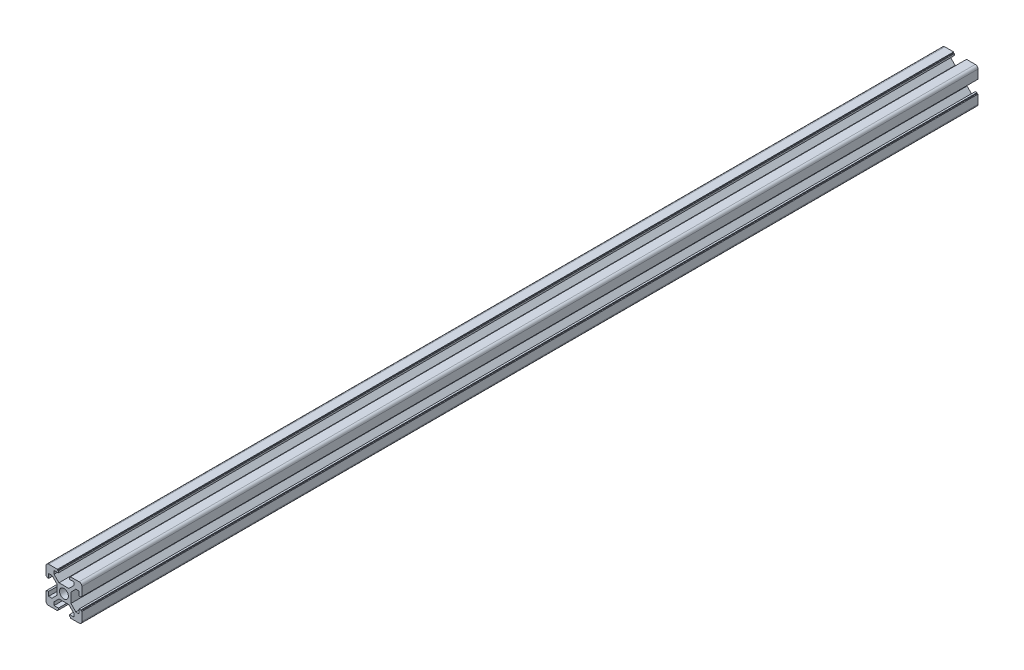
from build123d import *
from build123d.topology import SkipClean

# Parameters (mm, degrees)
EXTRUDE_1_DEPTH     = 500
SKETCH_2_R          = 2.05
CUT_EXTRUDE_1_DEPTH = 501.293124078
SKETCH_3_R          = 2.05
CUT_EXTRUDE_2_DEPTH = 27


with BuildPart() as part:
    # 草图1 → 凸台-拉伸1 (new body)
    with BuildSketch(Plane.XY):
        with BuildLine():
            Line((8.5, 10), (3.6, 10))
            Line((3.6, 10), (3.6, 9.5))
            Line((3.6, 9.5), (3.1, 9.5))
            Line((3.1, 9.5), (3.1, 8.5))
            Line((3.1, 8.5), (5.5, 8.5))
            Line((5.5, 8.5), (5.5, 6.65))
            Line((5.5, 6.65), (2.75, 3.9))
            Line((2.75, 3.9), (-2.75, 3.9))
            Line((-2.75, 3.9), (-5.5, 6.65))
            Line((-5.5, 6.65), (-5.5, 8.5))
            Line((-5.5, 8.5), (-3.1, 8.5))
            Line((-3.1, 8.5), (-3.1, 9.5))
            Line((-3.1, 9.5), (-3.6, 9.5))
            Line((-3.6, 9.5), (-3.6, 10))
            Line((-3.6, 10), (-8.5, 10))
            ThreePointArc((-8.5, 10), (-9.560660172, 9.560660172), (-10, 8.5))
            Line((-10, 8.5), (-10, 3.6))
            Line((-10, 3.6), (-9.5, 3.6))
            Line((-9.5, 3.6), (-9.5, 3.1))
            Line((-9.5, 3.1), (-8.5, 3.1))
            Line((-8.5, 3.1), (-8.5, 5.5))
            Line((-8.5, 5.5), (-6.65, 5.5))
            Line((-6.65, 5.5), (-3.9, 2.75))
            Line((-3.9, 2.75), (-3.9, -2.75))
            Line((-3.9, -2.75), (-6.65, -5.5))
            Line((-6.65, -5.5), (-8.5, -5.5))
            Line((-8.5, -5.5), (-8.5, -3.1))
            Line((-8.5, -3.1), (-9.5, -3.1))
            Line((-9.5, -3.1), (-9.5, -3.6))
            Line((-9.5, -3.6), (-10, -3.6))
            Line((-10, -3.6), (-10, -8.5))
            ThreePointArc((-10, -8.5), (-9.560660172, -9.560660172), (-8.5, -10))
            Line((-8.5, -10), (-3.6, -10))
            Line((-3.6, -10), (-3.6, -9.5))
            Line((-3.6, -9.5), (-3.1, -9.5))
            Line((-3.1, -9.5), (-3.1, -8.5))
            Line((-3.1, -8.5), (-5.5, -8.5))
            Line((-5.5, -8.5), (-5.5, -6.65))
            Line((-5.5, -6.65), (-2.75, -3.9))
            Line((-2.75, -3.9), (2.75, -3.9))
            Line((2.75, -3.9), (5.5, -6.65))
            Line((5.5, -6.65), (5.5, -8.5))
            Line((5.5, -8.5), (3.1, -8.5))
            Line((3.1, -8.5), (3.1, -9.5))
            Line((3.1, -9.5), (3.6, -9.5))
            Line((3.6, -9.5), (3.6, -10))
            Line((3.6, -10), (8.5, -10))
            ThreePointArc((8.5, -10), (9.560660172, -9.560660172), (10, -8.5))
            Line((10, -8.5), (10, -3.6))
            Line((10, -3.6), (9.5, -3.6))
            Line((9.5, -3.6), (9.5, -3.1))
            Line((9.5, -3.1), (8.5, -3.1))
            Line((8.5, -3.1), (8.5, -5.5))
            Line((8.5, -5.5), (6.65, -5.5))
            Line((6.65, -5.5), (3.9, -2.75))
            Line((3.9, -2.75), (3.9, 2.75))
            Line((3.9, 2.75), (6.65, 5.5))
            Line((6.65, 5.5), (8.5, 5.5))
            Line((8.5, 5.5), (8.5, 3.1))
            Line((8.5, 3.1), (9.5, 3.1))
            Line((9.5, 3.1), (9.5, 3.6))
            Line((9.5, 3.6), (10, 3.6))
            Line((10, 3.6), (10, 8.5))
            ThreePointArc((10, 8.5), (9.560660172, 9.560660172), (8.5, 10))
        make_face()
        with BuildLine():
            ThreePointArc((-2.5, 0), (0, -2.5), (2.5, 0))
            ThreePointArc((2.5, 0), (0, 2.5), (-2.5, 0))
        make_face(mode=Mode.SUBTRACT)
    extrude(amount=EXTRUDE_1_DEPTH)

    # 草图2 → 切除-拉伸1 (cut, through all)
    with BuildSketch(Plane(origin=(0, 3.9, 0), x_dir=(1, 0, 0), z_dir=(0, 1, 0))):
        with Locations(Location((0, -250, 0), (0, 0, 180))):
            Circle(SKETCH_2_R)
        with Locations(Location((0, -125, 0), (0, 0, 180))):
            Circle(SKETCH_2_R)
        with Locations(Location((0, -375, 0), (0, 0, 180))):
            Circle(SKETCH_2_R)
    extrude(amount=-CUT_EXTRUDE_1_DEPTH, mode=Mode.SUBTRACT)

    # 草图3 → 切除-拉伸2 (cut)
    with SkipClean():  # the faces are left unmerged after this step: merging them gives an invalid solid
        with BuildSketch(Plane(origin=(10, 0, 0), x_dir=(0, 0, -1), z_dir=(1, 0, 0))):
            with Locations(Location((-463, 0, 0), (0, 0, 179.999999997))):
                Circle(SKETCH_3_R)
            with Locations(Location((-441, 0, 0), (0, 0, 179.999999997))):
                Circle(SKETCH_3_R)
            with Locations(Location((-59, 0, 0), (0, 0, 179.999999997))):
                Circle(SKETCH_3_R)
            with Locations(Location((-37, 0, 0), (0, 0, 179.999999997))):
                Circle(SKETCH_3_R)
        extrude(amount=-CUT_EXTRUDE_2_DEPTH, mode=Mode.SUBTRACT)


solid = part.part
